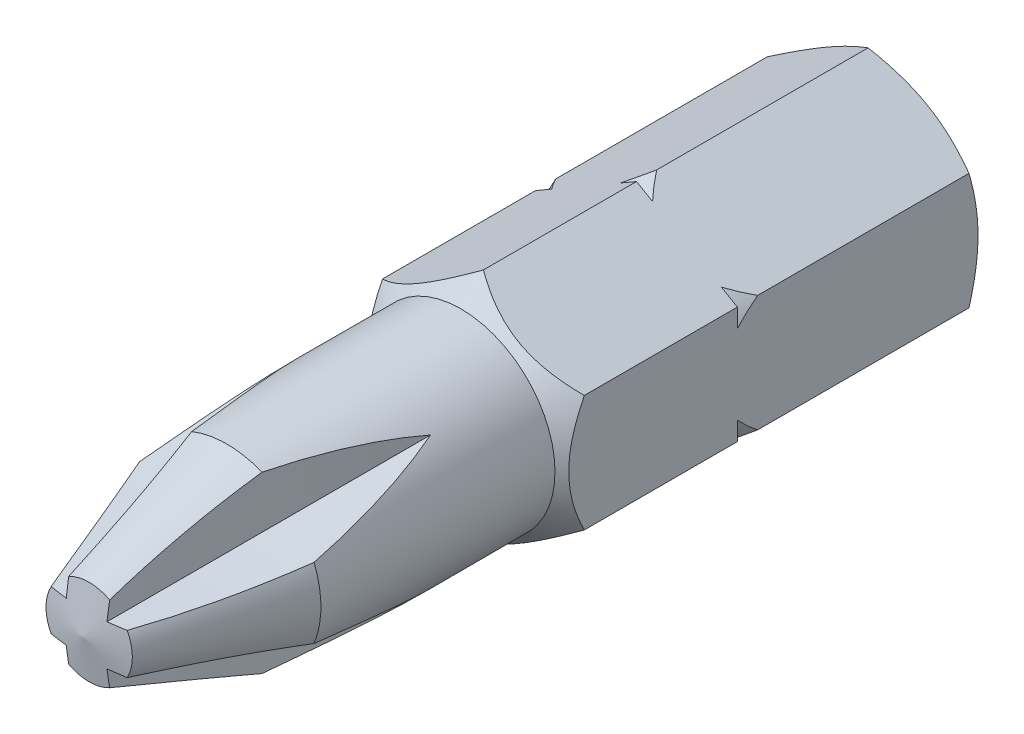
from build123d import *

# Parameters (mm, degrees)
SKETCH4_OUTSIDE_W  = 15.138
SKETCH4_OUTSIDE_H  = 15.138
CUT_EXTRUDE1_DEPTH = 13.462
SKETCH6_OUTSIDE_W  = 22.586
SKETCH6_OUTSIDE_H  = 23.568
SKETCH6_OUTSIDE_R  = 2.54
CUT_EXTRUDE6_DEPTH = 2.54
CUT_EXTRUDE6_DRAFT = -60
CIRPATTERN3_COUNT  = 4


with BuildPart() as part:
    # Sketch3 → Revolve1 (revolve)
    with BuildSketch(Plane(origin=(0, 0, 0), x_dir=(0, 0, -1), z_dir=(1, 0, 0)), mode=Mode.PRIVATE) as revolve1_sk:
        Polygon((-12.7, 0), (12.7, 0), (12.7, 3.81), (-0.762, 3.81), (-0.762, 2.9591), (-12.7, 2.9591), align=None)
    revolve(revolve1_sk.sketch.rotate(Axis((0, 0, 12.7), (0, 0, -1)), 180), axis=Axis((0, 0, 12.7), (0, 0, -1)))

    # Sketch4 outside → Cut-Extrude1 (cut)
    with BuildSketch(Plane(origin=(0, 0, -12.7), x_dir=(-1, 0, 0), z_dir=(0, 0, -1))):
        Rectangle(SKETCH4_OUTSIDE_W, SKETCH4_OUTSIDE_H)
        Polygon((3.175, 1.833087105), (0, 3.666174209), (-3.175, 1.833087105), (-3.175, -1.833087105), (0, -3.666174209), (3.175, -1.833087105), align=None, mode=Mode.SUBTRACT)
    extrude(amount=-CUT_EXTRUDE1_DEPTH, mode=Mode.SUBTRACT)


with BuildPart() as cut_extrude6_tool:
    # Sketch6 outside → Cut-Extrude6 (with draft: the straight prism first)
    with BuildSketch(Plane(origin=(0, 0, -12.7), x_dir=(-1, 0, 0), z_dir=(0, 0, -1))):
        Rectangle(SKETCH6_OUTSIDE_W, SKETCH6_OUTSIDE_H)
        Circle(SKETCH6_OUTSIDE_R, mode=Mode.SUBTRACT)
    extrude(amount=-CUT_EXTRUDE6_DEPTH)
    # Cut-Extrude6: the draft: its side faces are tilted about the plane it starts from
    cut_extrude6_sides = [cut_extrude6_tool.faces().sort_by_distance(p)[0] for p in [
        (0, -11.784, -11.43),
        (-11.293, 0, -11.43),
        (0, 11.784, -11.43),
        (11.293, 0, -11.43),
        (2.54, 0, -11.43),
    ]]
    draft(cut_extrude6_sides, Plane(origin=(0, 0, -12.7), x_dir=(-1, 0, 0), z_dir=(0, 0, -1)), CUT_EXTRUDE6_DRAFT)


with BuildPart() as part_1:
    add(part.part)

    # Cut-Extrude6: cut by cut_extrude6_tool
    add(cut_extrude6_tool.part, mode=Mode.SUBTRACT)

    # Sketch12 → Cut-Revolve2 (revolve, cut)
    with BuildSketch(Plane(origin=(0, 0, 0), x_dir=(0, 0, -1), z_dir=(1, 0, 0))):
        Polygon((-0.762, 2.9591), (-0.762, 3.666174209), (-0.054925791, 3.666174209), align=None)
    revolve(axis=Axis((0, 0, 12.7), (0, 0, -1)), mode=Mode.SUBTRACT)

    # Cut-Sweep3: sweep along a path in Sketch10
    with BuildLine(Plane(origin=(0, 0, 0), x_dir=(0, 0, -1), z_dir=(0.7071067811865464, -0.7071067811865488, 0))) as cut_sweep3_path:
        ThreePointArc((-12.7, 0.898025612), (-8.161677229, 1.526035155), (-3.81, 2.9591))
    # Sketch7 → Cut-Sweep3 (sweep, cut)
    with BuildSketch(Plane.XY.offset(12.7)):
        with BuildLine():
            Line((0.635, 3.144163976), (0.635, 0.635))
            Line((0.635, 0.635), (3.144163976, 0.635))
            ThreePointArc((3.144163976, 0.635), (2.268148155, 2.268148155), (0.635, 3.144163976))
        make_face()
    cut_sweep3 = sweep(path=cut_sweep3_path.line, mode=Mode.SUBTRACT)

    # CirPattern3: Cut-Sweep3 ×4 about axis
    cirpattern3_axis = Axis((0, 0, 12.7), (0, 0, -1))
    for i in range(1, CIRPATTERN3_COUNT):
        add(cut_sweep3.rotate(cirpattern3_axis, i * 360 / CIRPATTERN3_COUNT), mode=Mode.SUBTRACT)

    # Sketch11 → Cut-Revolve1 (revolve, cut)
    with BuildSketch(Plane(origin=(0, 0, 0), x_dir=(1, 0, 0), z_dir=(0, 1, 0)), mode=Mode.PRIVATE) as cut_revolve1_sk:
        Polygon((1.27, -12.7), (2.9591, -8.128), (2.9591, -12.7), align=None)
    revolve(cut_revolve1_sk.sketch.rotate(Axis((0, 0, 12.7), (0, 0, -1)), 90), axis=Axis((0, 0, 12.7), (0, 0, -1)), mode=Mode.SUBTRACT)

    # Sketch13 → Cut-Revolve4 (revolve, cut)
    with BuildSketch(Plane(origin=(0, 0, 0), x_dir=(0, 0, -1), z_dir=(1, 0, 0))):
        Polygon((-12.7, 0.00254), (-12.46093948, 1.358319581), (-12.7, 1.358319581), align=None)
    revolve(axis=Axis((0, 0, 12.7), (0, 0, -1)), mode=Mode.SUBTRACT)

    # Sketch16 → Cut-Revolve5 (revolve, cut)
    with BuildSketch(Plane(origin=(0, 0, 0), x_dir=(0, 0, -1), z_dir=(1, 0, 0))):
        Polygon((4.7625, 3.666174209), (4.7625, 3.412174209), (5.3975, 3.666174209), align=None)
    revolve(axis=Axis((0, 0, 12.7), (0, 0, -1)), mode=Mode.SUBTRACT)


solid = part_1.part
